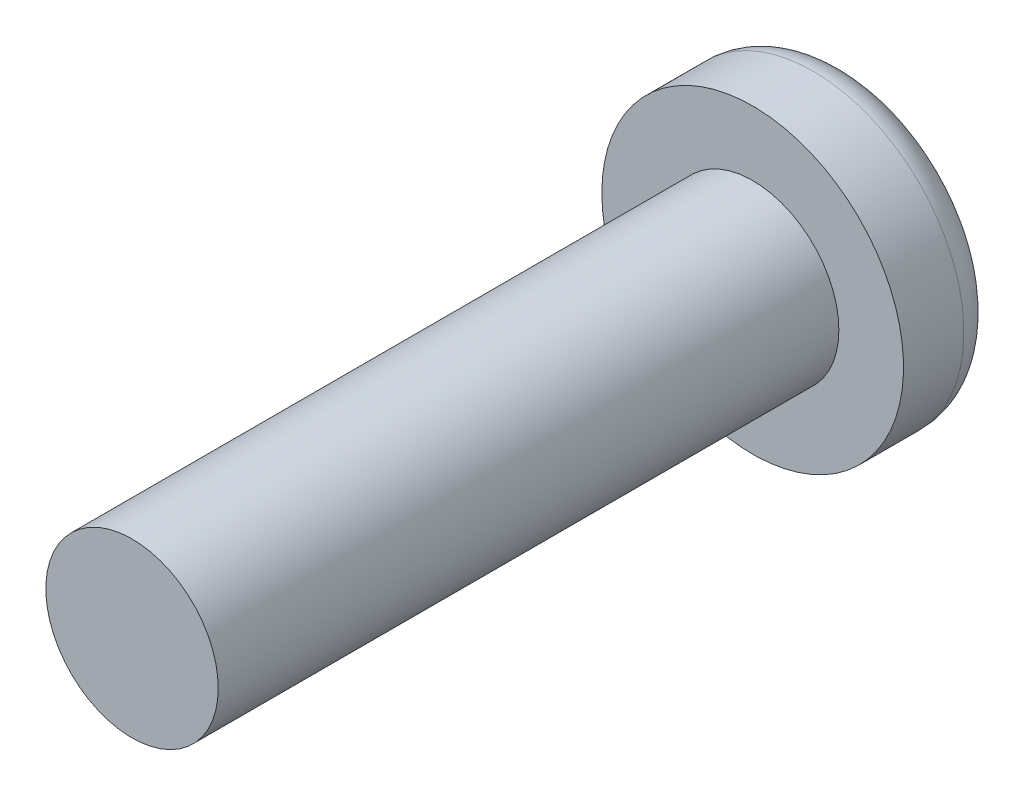
from build123d import *

# Parameters (mm, degrees)
SKETCH_1_R          = 5
EXTRUDE_1_DEPTH     = 36
SKETCH_2_R          = 8.75
EXTRUDE_2_DEPTH     = 5.5
FILLET_1_R          = 2
CUT_EXTRUDE_1_DEPTH = 2


with BuildPart() as part:
    # 草图1 → 凸台-拉伸1 (new body)
    with BuildSketch(Plane.XY):
        Circle(SKETCH_1_R)
    extrude(amount=EXTRUDE_1_DEPTH)

    # 草图2 → 凸台-拉伸2 (add)
    with BuildSketch(Plane(origin=(0, 0, 0), x_dir=(-1, 0, 0), z_dir=(0, 0, -1))):
        Circle(SKETCH_2_R)
    extrude(amount=EXTRUDE_2_DEPTH)

    # 圆角1
    fillet_1_edges = [part.edges().sort_by_distance(p)[0] for p in [
        (8.75, 0, -5.5),
    ]]
    fillet(fillet_1_edges, radius=FILLET_1_R)

    # 草图3 → 切除-拉伸1 (cut)
    with BuildSketch(Plane(origin=(0, 0, -5.5), x_dir=(-1, 0, 0), z_dir=(0, 0, -1))):
        Polygon((-0.707106781, 0.707106781), (-0.707106781, 6.006401657), (0.707106781, 6.006401657), (0.707106781, 0.707106781), (6.006401657, 0.707106781), (6.006401657, -0.707106781), (0.707106781, -0.707106781), (0.707106781, -6.006401657), (-0.707106781, -6.006401657), (-0.707106781, -0.707106781), (-6.006401657, -0.707106781), (-6.006401657, 0.707106781), align=None)
    extrude(amount=-CUT_EXTRUDE_1_DEPTH, mode=Mode.SUBTRACT)


solid = part.part
